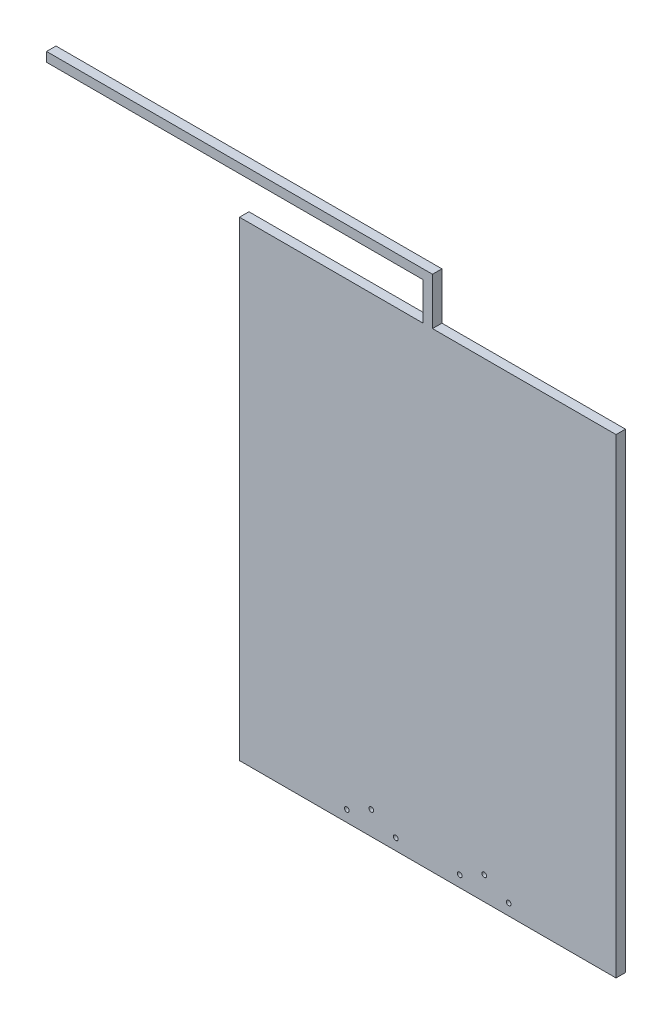
from build123d import *

# Parameters (mm, degrees)
SKETCH1_W           = 400
SKETCH1_H           = 500
BOSS_EXTRUDE1_DEPTH = 10
SKETCH2_R           = 2.5
CUT_EXTRUDE1_DEPTH  = 321.312347561
SKETCH3_W           = 10
SKETCH3_H           = 10
BOSS_EXTRUDE2_DEPTH = 50
SKETCH4_W           = 10
SKETCH4_H           = 10
BOSS_EXTRUDE3_DEPTH = 400
SKETCH5_R           = 2.5
CUT_EXTRUDE2_DEPTH  = 10


with BuildPart() as part:
    # Sketch1 → Boss-Extrude1 (new body)
    with BuildSketch(Plane.XY):
        Rectangle(SKETCH1_W, SKETCH1_H)
    extrude(amount=BOSS_EXTRUDE1_DEPTH)

    # Sketch2 → Cut-Extrude1 (cut, through all)
    with BuildSketch(Plane.XY.offset(10)):
        with Locations((-86, -238)):
            Circle(SKETCH2_R)
        with Locations((-60, -225)):
            Circle(SKETCH2_R)
        with Locations((-34, -238)):
            Circle(SKETCH2_R)
        with Locations((34, -238)):
            Circle(SKETCH2_R)
        with Locations((60, -225)):
            Circle(SKETCH2_R)
        with Locations((86, -238)):
            Circle(SKETCH2_R)
    extrude(amount=-CUT_EXTRUDE1_DEPTH, mode=Mode.SUBTRACT)

    # Sketch3 → Boss-Extrude2 (add)
    with BuildSketch(Plane(origin=(0, 250, 0), x_dir=(1, 0, 0), z_dir=(0, 1, 0))):
        with Locations((0, -5)):
            Rectangle(SKETCH3_W, SKETCH3_H)
    extrude(amount=BOSS_EXTRUDE2_DEPTH)

    # Sketch4 → Boss-Extrude3 (add)
    with BuildSketch(Plane.ZY.offset(5)):
        with Locations((5, 295)):
            Rectangle(SKETCH4_W, SKETCH4_H)
    extrude(amount=BOSS_EXTRUDE3_DEPTH)

    # Sketch5 → Cut-Extrude2 (cut)
    with BuildSketch(Plane.ZY.offset(405)):
        with Locations(Location((5, 295, 0), (0, 0, 270))):
            Circle(SKETCH5_R)
    extrude(amount=-CUT_EXTRUDE2_DEPTH, mode=Mode.SUBTRACT)


solid = part.part
